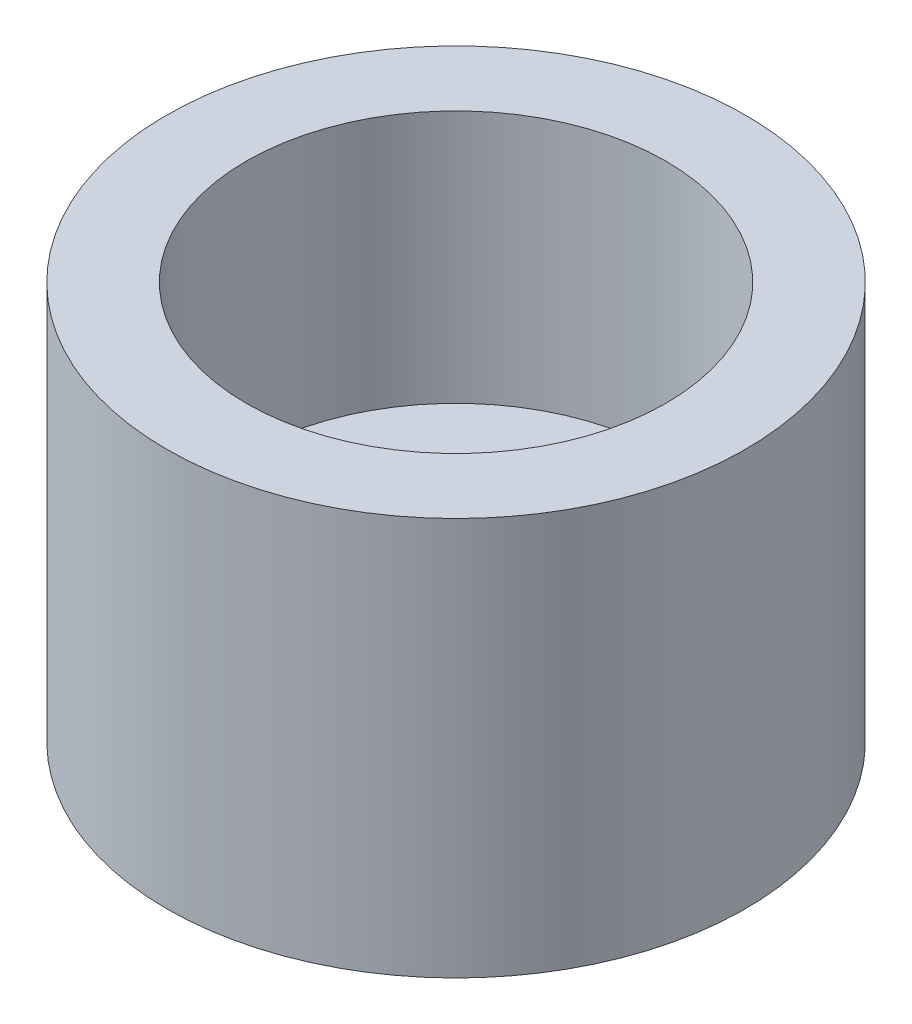
from build123d import *

# Parameters (mm, degrees)
SKETCH_1_R      = 4
EXTRUDE_1_DEPTH = 2
SKETCH_2_R      = 4
SKETCH_2_R_2    = 2.9
EXTRUDE_2_DEPTH = 3.5


with BuildPart() as part:
    # 草图1 → 凸台-拉伸1 (new body)
    with BuildSketch(Plane(origin=(0, 0, 0), x_dir=(1, 0, 0), z_dir=(0, 1, 0))):
        with Locations(Location((0, 0, 0), (0, 0, 270))):
            Circle(SKETCH_1_R)
    extrude(amount=EXTRUDE_1_DEPTH)

    # 草图2 → 凸台-拉伸2 (add)
    with BuildSketch(Plane(origin=(0, 2, 0), x_dir=(1, 0, 0), z_dir=(0, 1, 0))):
        with Locations(Location((0, 0, 0), (0, 0, 270))):
            Circle(SKETCH_2_R)
        with Locations(Location((0, 0, 0), (0, 0, 270))):
            Circle(SKETCH_2_R_2, mode=Mode.SUBTRACT)
    extrude(amount=EXTRUDE_2_DEPTH)


solid = part.part
